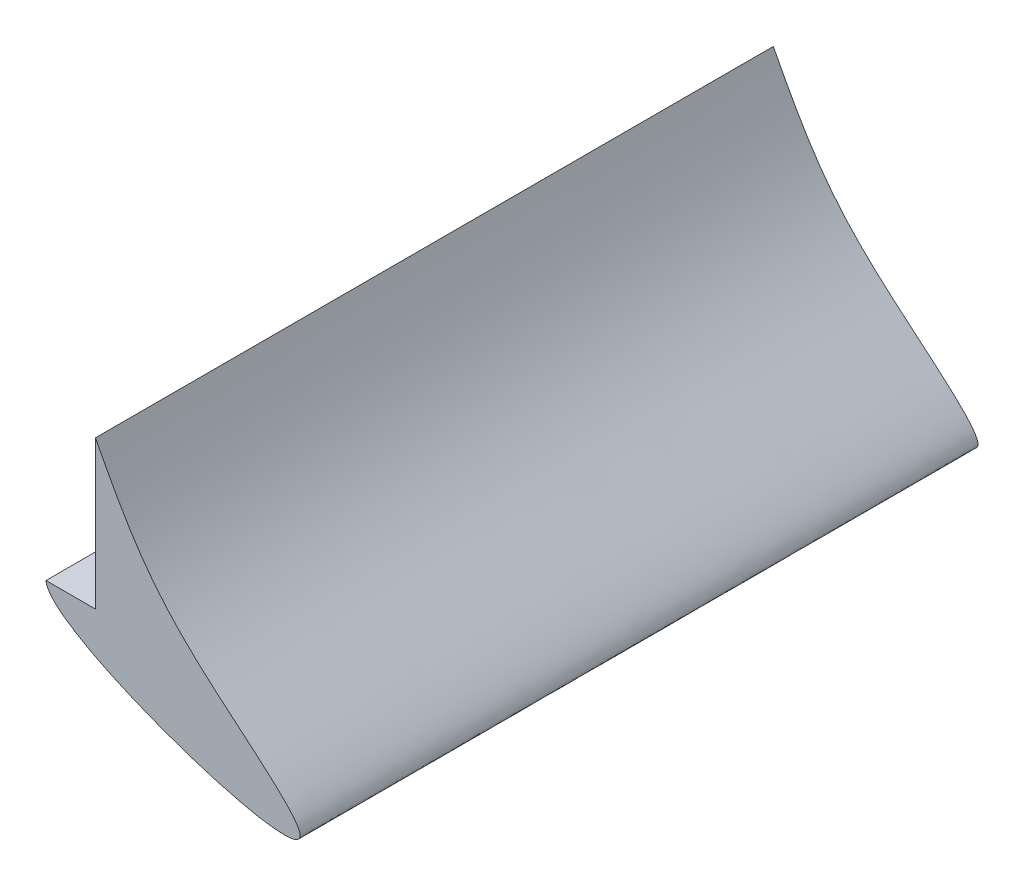
from build123d import *

# Parameters (mm, degrees)
BOSS_EXTRUDE2_DEPTH = 68.58


with BuildPart() as part:
    # Sketch1 → Boss-Extrude2 (new body)
    with BuildSketch(Plane.XY):
        with BuildLine():
            Line((0, 0), (5, 0))
            Line((5, 0), (5, 15))
            add(Edge.make_bspline(
                [(0, 0), (0.287516011, -4.189568371), (37.817657062, -16.873910744), (11.93083236, 2.276577168), (8.32097676, 8.646201762), (5, 15)],
                knots=[0, 0, 0, 0, 0.463325364, 0.69050729, 1, 1, 1, 1], degree=3))
        make_face()
    extrude(amount=BOSS_EXTRUDE2_DEPTH)


solid = part.part
